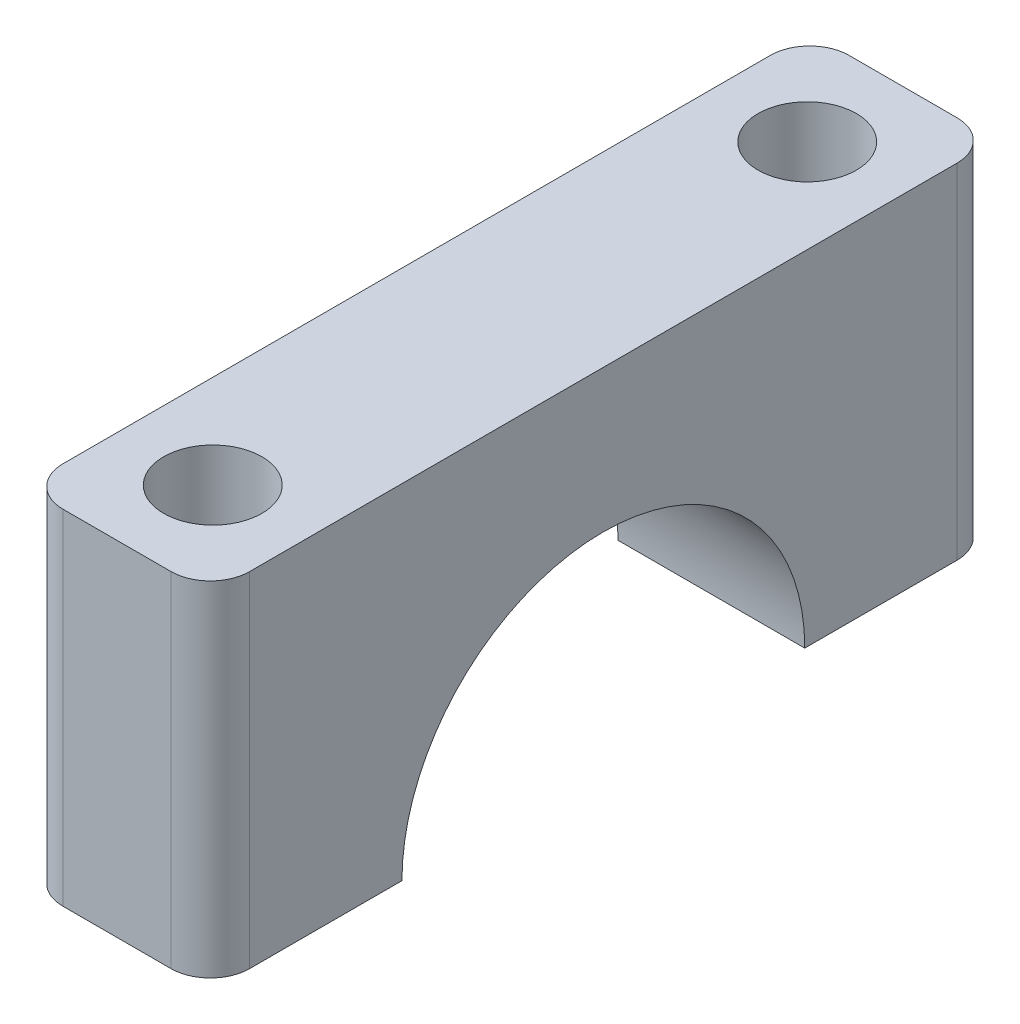
from build123d import *

# Parameters (mm, degrees)
SKETCH1_W           = 19
SKETCH1_H           = 80
BOSS_EXTRUDE1_DEPTH = 35
CUT_EXTRUDE1_DEPTH  = 35
SKETCH3_R           = 5
CUT_EXTRUDE2_DEPTH  = 35
FILLET1_R           = 4


with BuildPart() as part:
    # Sketch1 → Boss-Extrude1 (new body)
    with BuildSketch(Plane(origin=(0, 0, 0), x_dir=(1, 0, 0), z_dir=(0, 1, 0))):
        Rectangle(SKETCH1_W, SKETCH1_H)
    extrude(amount=BOSS_EXTRUDE1_DEPTH)

    # Sketch2 → Cut-Extrude1 (cut)
    with BuildSketch(Plane(origin=(9.5, 0, 0), x_dir=(0, 0, -1), z_dir=(1, 0, 0))):
        with BuildLine():
            ThreePointArc((20.5, 0), (0, 20.5), (-20.5, 0))
            Line((-20.5, 0), (20.5, 0))
        make_face()
        with BuildLine():
            Line((20.5, 0), (-20.5, 0))
            ThreePointArc((-20.5, 0), (0, -20.5), (20.5, 0))
        make_face()
    extrude(amount=-CUT_EXTRUDE1_DEPTH, mode=Mode.SUBTRACT)

    # Sketch3 → Cut-Extrude2 (cut)
    with BuildSketch(Plane.XZ):
        with Locations(Location((0, -30.25, 0), (0, 0, 270))):
            Circle(SKETCH3_R)
        with Locations(Location((0, 30.25, 0), (0, 0, 270))):
            Circle(SKETCH3_R)
    extrude(amount=-CUT_EXTRUDE2_DEPTH, mode=Mode.SUBTRACT)

    # Fillet1
    fillet1_edges = [part.edges().sort_by_distance(p)[0] for p in [
        (9.5, 17.5, 40),
        (-9.5, 17.5, 40),
        (-9.5, 17.5, -40),
        (9.5, 17.5, -40),
    ]]
    fillet(fillet1_edges, radius=FILLET1_R)


solid = part.part
